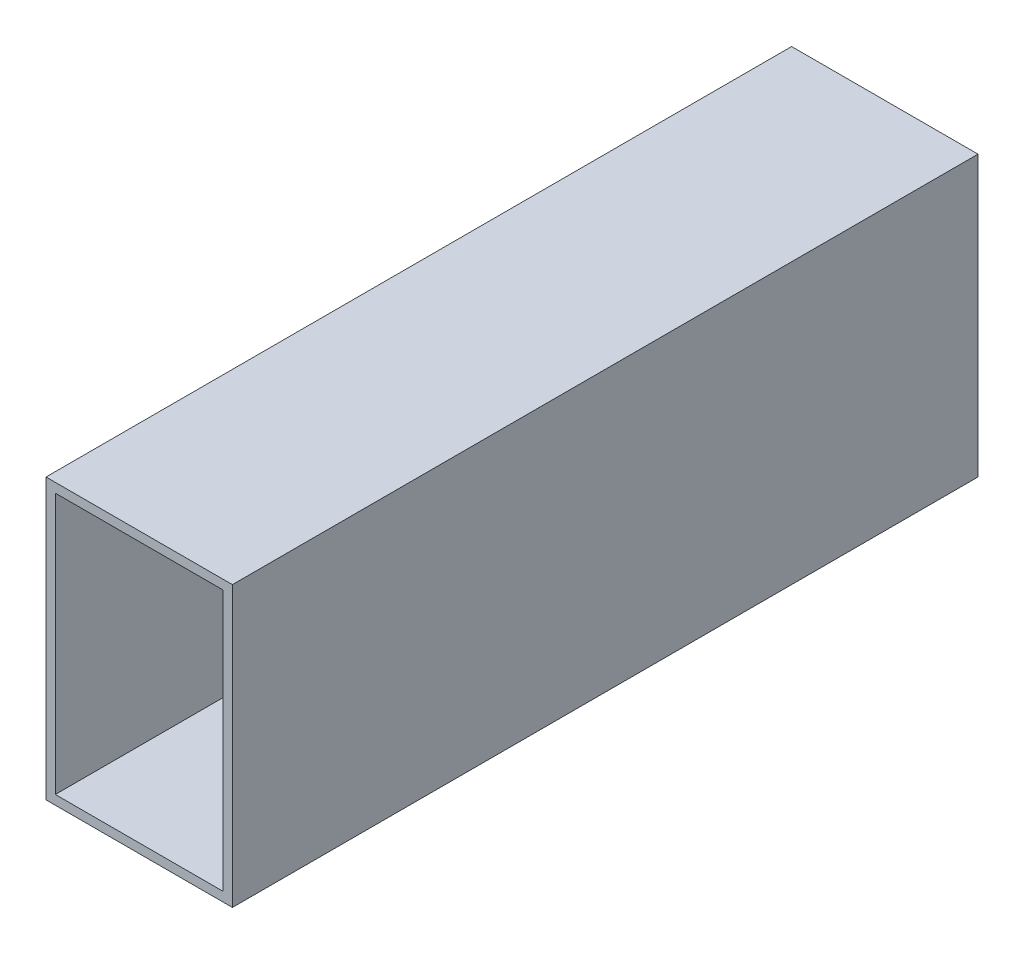
from build123d import *

# Parameters (mm, degrees)
SKETCH1_W           = 320
SKETCH1_H           = 120
BOSS_EXTRUDE1_DEPTH = 40
SHELL1_T            = -4


with BuildPart() as part:
    # Sketch1 → Boss-Extrude1 (new, symmetric)
    with BuildSketch(Plane(origin=(0, 0, 0), x_dir=(0, 0, -1), z_dir=(1, 0, 0))):
        Rectangle(SKETCH1_W, SKETCH1_H)
    extrude(amount=BOSS_EXTRUDE1_DEPTH, both=True)

    # Shell1
    shell1_openings = [part.faces().sort_by_distance(p)[0] for p in [
        (0, 0, -160),
        (0, 0, 160),
    ]]
    offset(amount=SHELL1_T, openings=shell1_openings, kind=Kind.INTERSECTION)


solid = part.part
